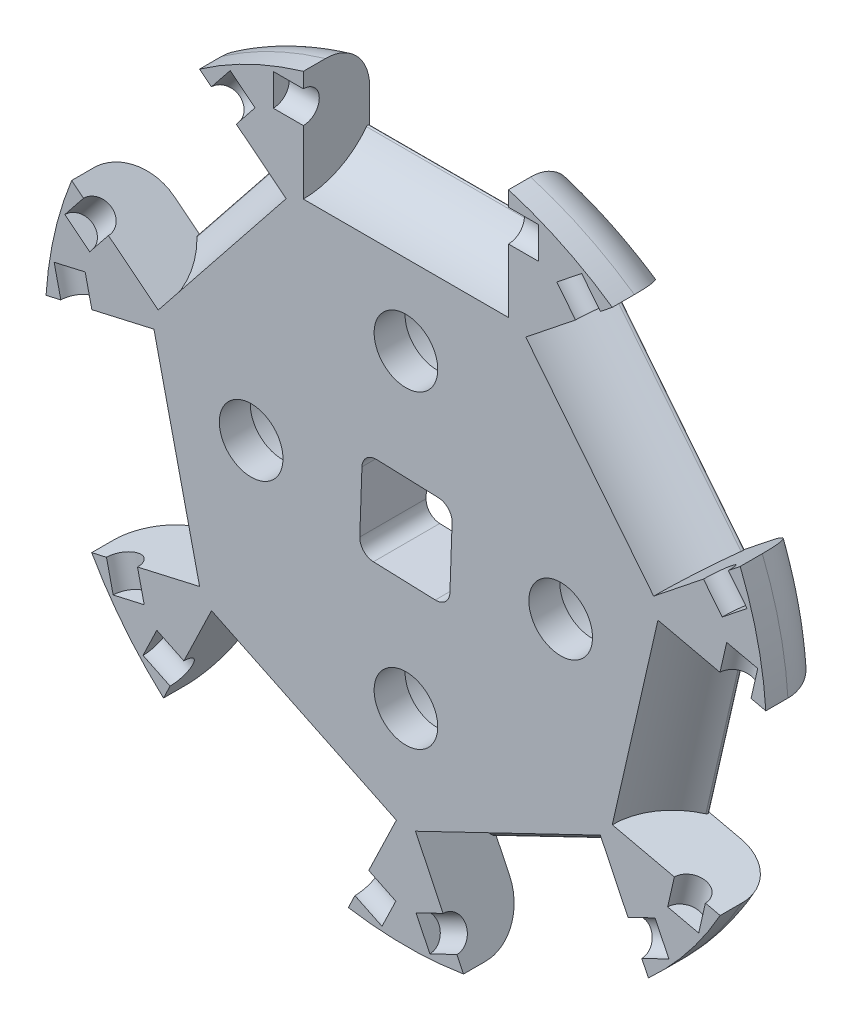
from build123d import *

# Parameters (mm, degrees)
SKETCH1_R                = 25.8953
BOSS_EXTRUDE2_DEPTH      = 4.7625
FILLET1_R                = 3.175
SKETCH2_W                = 14.732
SKETCH2_H                = 10.414
CUT_EXTRUDE2_DEPTH       = 12.7
CIRPATTERN1_COUNT        = 7
SKETCH4_R                = 1.143
CUT_EXTRUDE4_DEPTH       = 9.525
CIRPATTERN2_COUNT        = 7
CUT_EXTRUDE5_DEPTH       = 37.89266219
SKETCH6_R                = 2.286
CUT_EXTRUDE7_DEPTH       = 37.89266219
SKETCH7_R                = 4.445
CUT_EXTRUDE8_DEPTH       = 2.54
BOSS_EXTRUDE4_REACH      = 44.38
FILLET2_R                = 0.127
CIRPATTERN5_COUNT        = 7
FILLET2_OF_CIRPATTERN5_R = 0.127
FILLET3_R                = 1.016


with BuildPart() as part:
    # Sketch1 → Boss-Extrude2 (new body)
    with BuildSketch(Plane.XY):
        Circle(SKETCH1_R)
    extrude(amount=-BOSS_EXTRUDE2_DEPTH)

    # Fillet1
    fillet1_edges = [part.edges().sort_by_distance(p)[0] for p in [
        (-25.8953, 0, -4.7625),
    ]]
    fillet(fillet1_edges, radius=FILLET1_R)

    # Sketch2 → Cut-Extrude2 (cut)
    with BuildSketch(Plane.XY):
        with Locations((0, 21.9583)):
            Rectangle(SKETCH2_W, SKETCH2_H)
    cut_extrude2 = extrude(amount=-CUT_EXTRUDE2_DEPTH, mode=Mode.SUBTRACT)

    # CirPattern1: Cut-Extrude2 ×7 about axis
    cirpattern1_axis = Axis((0, 0, 0), (0, 0, 1))
    for i in range(1, CIRPATTERN1_COUNT):
        add(cut_extrude2.rotate(cirpattern1_axis, i * 360 / CIRPATTERN1_COUNT), mode=Mode.SUBTRACT)

    # Sketch4 → Cut-Extrude4 (cut, symmetric)
    with BuildSketch(Plane(origin=(0, 0, 0), x_dir=(0, 0, -1), z_dir=(1, 0, 0))):
        with Locations((0, 22.5933)):
            Circle(SKETCH4_R)
    cut_extrude4 = extrude(amount=CUT_EXTRUDE4_DEPTH, both=True, mode=Mode.SUBTRACT)

    # CirPattern2: Cut-Extrude4 ×7 about axis
    cirpattern2_axis = Axis((0, 0, 0), (0, 0, 1))
    for i in range(1, CIRPATTERN2_COUNT):
        add(cut_extrude4.rotate(cirpattern2_axis, i * 360 / CIRPATTERN2_COUNT), mode=Mode.SUBTRACT)

    # Sketch5 → Cut-Extrude5 (cut, through all)
    with BuildSketch(Plane.XY):
        Polygon((-3.349549213, -3.123505173), (3.123505173, -3.349549213), (3.349549213, 3.123505173), (-3.123505173, 3.349549213), align=None)
    extrude(amount=-CUT_EXTRUDE5_DEPTH, mode=Mode.SUBTRACT)

    # Sketch6 → Cut-Extrude7 (cut, through all)
    with BuildSketch(Plane(origin=(0, 0, -4.7625), x_dir=(-1, 0, 0), z_dir=(0, 0, -1))):
        with Locations((0, 11.1125)):
            Circle(SKETCH6_R)
        with Locations((11.1125, 0)):
            Circle(SKETCH6_R)
        with Locations((0, -11.1125)):
            Circle(SKETCH6_R)
        with Locations((-11.1125, 0)):
            Circle(SKETCH6_R)
    extrude(amount=-CUT_EXTRUDE7_DEPTH, mode=Mode.SUBTRACT)

    # Sketch7 → Cut-Extrude8 (cut)
    with BuildSketch(Plane(origin=(0, 0, -4.7625), x_dir=(-1, 0, 0), z_dir=(0, 0, -1))):
        with Locations((-11.1125, 0)):
            Circle(SKETCH7_R)
        with Locations((11.1125, 0)):
            Circle(SKETCH7_R)
        with Locations((0, -11.1125)):
            Circle(SKETCH7_R)
        with Locations((0, 11.1125)):
            Circle(SKETCH7_R)
    extrude(amount=-CUT_EXTRUDE8_DEPTH, mode=Mode.SUBTRACT)

    # Sketch10 → Boss-Extrude4 (add, up to next)
    with BuildSketch(Plane.ZY.offset(-7.366), mode=Mode.PRIVATE) as boss_extrude4_sk1:
        with BuildLine():
            Line((-4.7625, 16.7513), (0, 16.7513))
            Line((0, 16.7513), (0, 16.8783))
            ThreePointArc((0, 16.8783), (-2.7025038, 17.55765722), (-4.7625, 19.434214887))
            Line((-4.7625, 19.434214887), (-4.7625, 16.7513))
        make_face()
    boss_extrude4_tool1 = extrude(boss_extrude4_sk1.sketch, amount=BOSS_EXTRUDE4_REACH, mode=Mode.PRIVATE) - part.part
    boss_extrude4 = boss_extrude4_tool1.solids().sort_by_distance((7.366, 17.489807, -3.452063))[0]
    add(boss_extrude4)

    # Fillet2
    fillet2_edges = [part.edges().sort_by_distance(p)[0] for p in [
        (0, 19.434214887, -4.7625),
    ]]
    fillet(fillet2_edges, radius=FILLET2_R)

    # CirPattern5: Boss-Extrude4 ×7 about axis
    cirpattern5_axis = Axis((0, 0, 0), (0, 0, 1))
    for i in range(1, CIRPATTERN5_COUNT):
        add(boss_extrude4.rotate(cirpattern5_axis, i * 360 / CIRPATTERN5_COUNT))

    # Fillet2 of CirPattern5
    fillet2_of_cirpattern5_edges = [part.edges().sort_by_distance(p)[0] for p in [
        (-15.194281036, 12.117034789, -4.7625),
        (-18.946958545, -4.324519647, -4.7625),
        (-8.432189822, -17.509622585, -4.7625),
        (8.432189822, -17.509622585, -4.7625),
        (18.946958545, -4.324519647, -4.7625),
        (15.194281036, 12.117034789, -4.7625),
    ]]
    fillet(fillet2_of_cirpattern5_edges, radius=FILLET2_OF_CIRPATTERN5_R)

    # Fillet3
    fillet3_edges = [part.edges().sort_by_distance(p)[0] for p in [
        (3.349549213, 3.123505173, -2.38125),
        (3.123505173, -3.349549213, -2.38125),
        (-3.349549213, -3.123505173, -2.38125),
        (-3.123505173, 3.349549213, -2.38125),
    ]]
    fillet(fillet3_edges, radius=FILLET3_R)


solid = part.part
